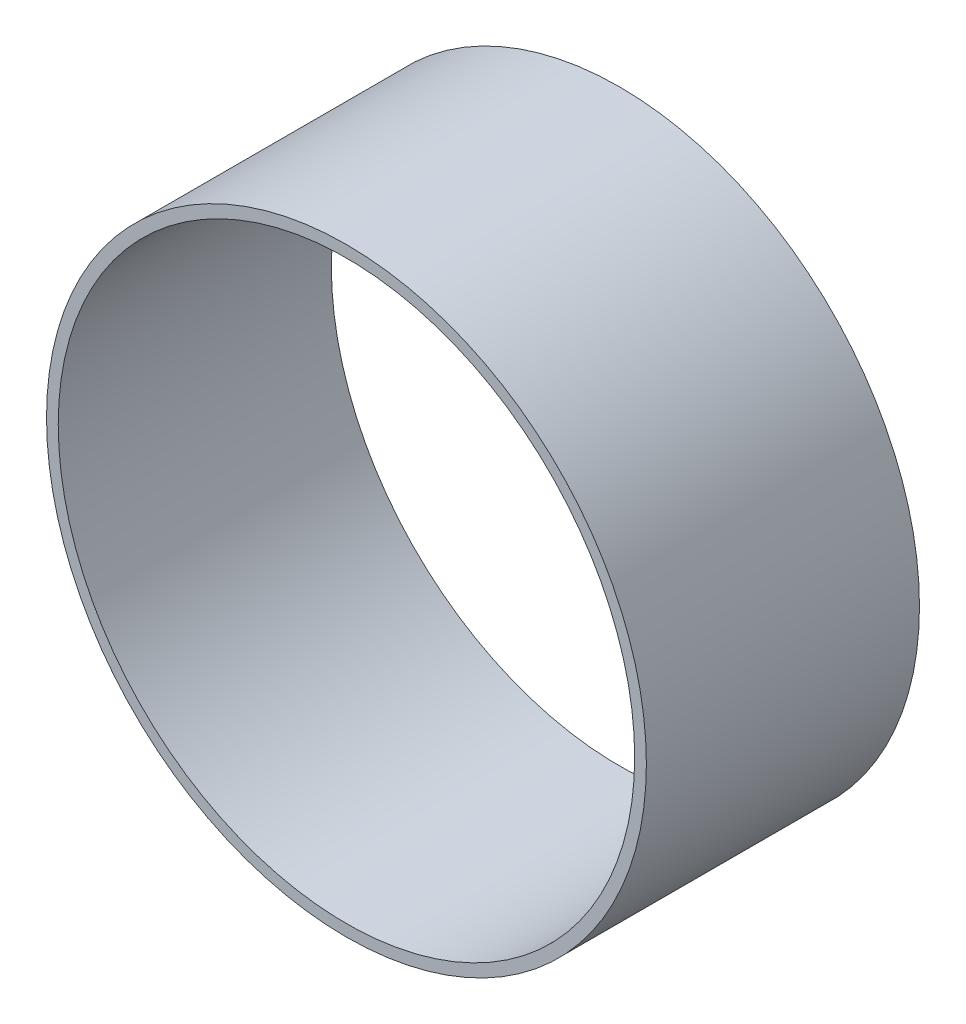
from build123d import *

# Parameters (mm, degrees)
ROTOR_SHELL_START = -35
SKETCH_1_R        = 76.876923077
SKETCH_1_R_2      = 73.876923077
ROTOR_SHELL_DEPTH = 70


with BuildPart() as part:
    # Эскиз1 → Rotor_shell (new body)
    with BuildSketch(Plane.XY.offset(ROTOR_SHELL_START)):
        Circle(SKETCH_1_R)
        Circle(SKETCH_1_R_2, mode=Mode.SUBTRACT)
    extrude(amount=ROTOR_SHELL_DEPTH)


solid = part.part
